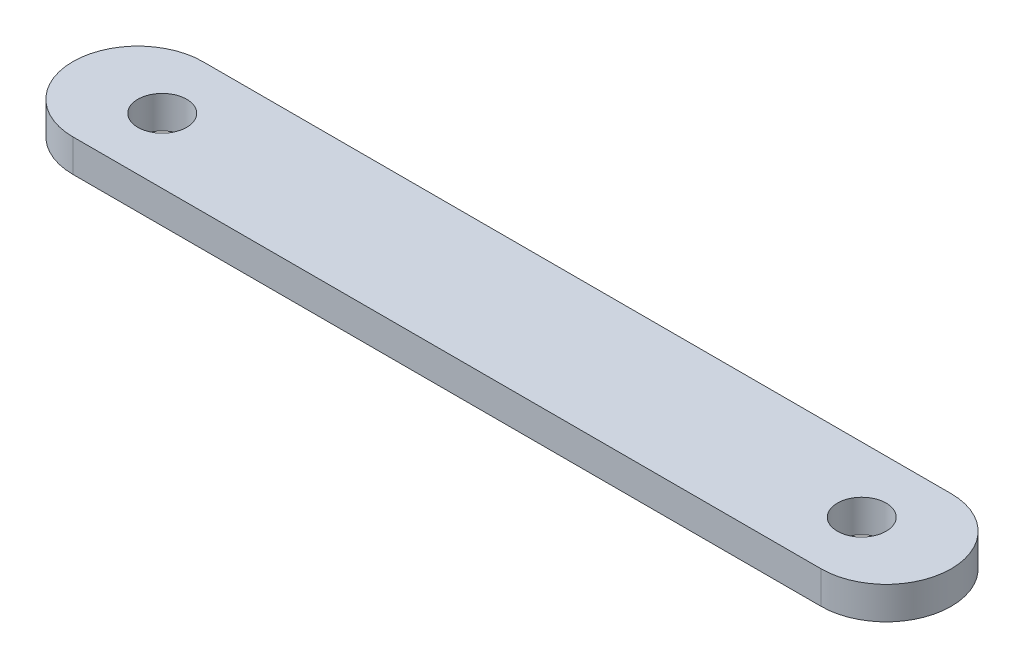
from build123d import *

# Parameters (mm, degrees)
SKETCH1_R           = 75
BOSS_EXTRUDE1_DEPTH = 100


with BuildPart() as part:
    # Sketch1 → Boss-Extrude1 (new body)
    with BuildSketch(Plane(origin=(0, 0, 0), x_dir=(1, 0, 0), z_dir=(0, 1, 0))):
        with BuildLine():
            Line((1150, -200), (-1150, -200))
            ThreePointArc((-1150, -200), (-1350, 0), (-1150, 200))
            Line((-1150, 200), (1150, 200))
            ThreePointArc((1150, 200), (1350, 0), (1150, -200))
        make_face()
        with Locations(Location((-1075, 0, 0), (0, 0, 270))):
            Circle(SKETCH1_R, mode=Mode.SUBTRACT)
        with Locations(Location((1075, 0, 0), (0, 0, 270))):
            Circle(SKETCH1_R, mode=Mode.SUBTRACT)
    extrude(amount=BOSS_EXTRUDE1_DEPTH)


solid = part.part
